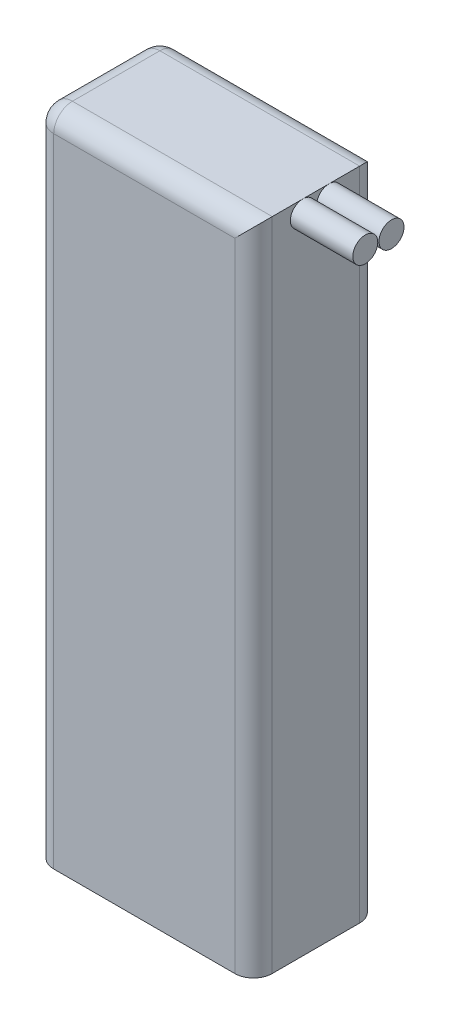
from build123d import *

# Parameters (mm, degrees)
SKETCH2_W           = 35
SKETCH2_H           = 20
BOSS_EXTRUDE1_DEPTH = 105
SKETCH5_R           = 2
BOSS_EXTRUDE2_DEPTH = 10
FILLET1_R           = 3


with BuildPart() as part:
    # Sketch2 → Boss-Extrude1 (new body)
    with BuildSketch(Plane(origin=(0, 0, 0), x_dir=(1, 0, 0), z_dir=(0, 1, 0))):
        with Locations((17.5, 10)):
            Rectangle(SKETCH2_W, SKETCH2_H)
    extrude(amount=BOSS_EXTRUDE1_DEPTH)

    # Sketch5 → Boss-Extrude2 (add)
    with BuildSketch(Plane(origin=(35, 0, 0), x_dir=(0, 0, -1), z_dir=(1, 0, 0))):
        with Locations(Location((7.9, 103, 0), (0, 0, 90))):
            Circle(SKETCH5_R)
        with Locations(Location((12.1, 103, 0), (0, 0, 90))):
            Circle(SKETCH5_R)
    extrude(amount=BOSS_EXTRUDE2_DEPTH)

    # Fillet1
    fillet1_edges = [part.edges().sort_by_distance(p)[0] for p in [
        (17.5, 105, -20),
        (0, 105, -10),
        (0, 52.5, -20),
        (35, 52.5, -20),
        (35, 52.5, 0),
        (0, 52.5, 0),
        (17.5, 105, 0),
    ]]
    fillet(fillet1_edges, radius=FILLET1_R)


solid = part.part
